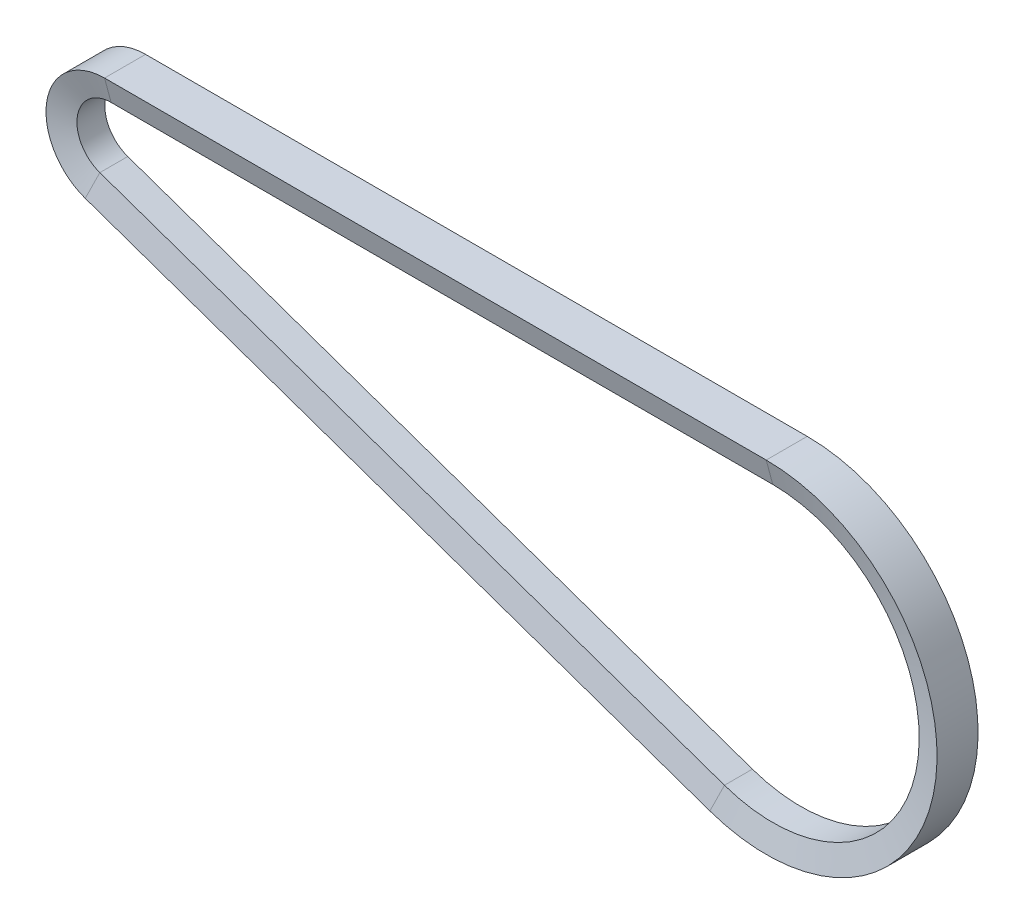
from build123d import *

# Parameters (mm, degrees)
RESSALTO_EXTRUS_O1_DEPTH = 5


with BuildPart() as part:
    # Varredura1: sweep along a path in Esboço1
    with BuildLine(Plane.XY) as varredura1_path:
        Line((0, 0), (-133.062716113, 0))
        ThreePointArc((-133.062716113, 0), (-146.86546539, -11.658181818), (-137.680363144, -27.216555372))
        Line((-137.680363144, -27.216555372), (118.272800267, -116.642380165))
        ThreePointArc((118.272800267, -116.642380165), (197.217355872, -70.036363636), (138.062716113, 0))
        Line((138.062716113, 0), (5, 0))
    # Esboço2 → Varredura1 (sweep)
    with BuildSketch(Plane(origin=(0, 0, 0), x_dir=(0, 0, -1), z_dir=(1, 0, 0))):
        Polygon((-8.4, 10), (8.4, 10), (5.720508076, 0), (-5.720508076, 0), align=None)
    sweep(path=varredura1_path.line)

    # Esboço3 → Ressalto-extrusão1 (add)
    with BuildSketch(Plane(origin=(0, 0, 0), x_dir=(0, 0, -1), z_dir=(1, 0, 0))):
        Polygon((-8.4, 10), (-5.720508076, 0), (5.720508076, 0), (8.4, 10), align=None)
    extrude(amount=RESSALTO_EXTRUS_O1_DEPTH)


solid = part.part
